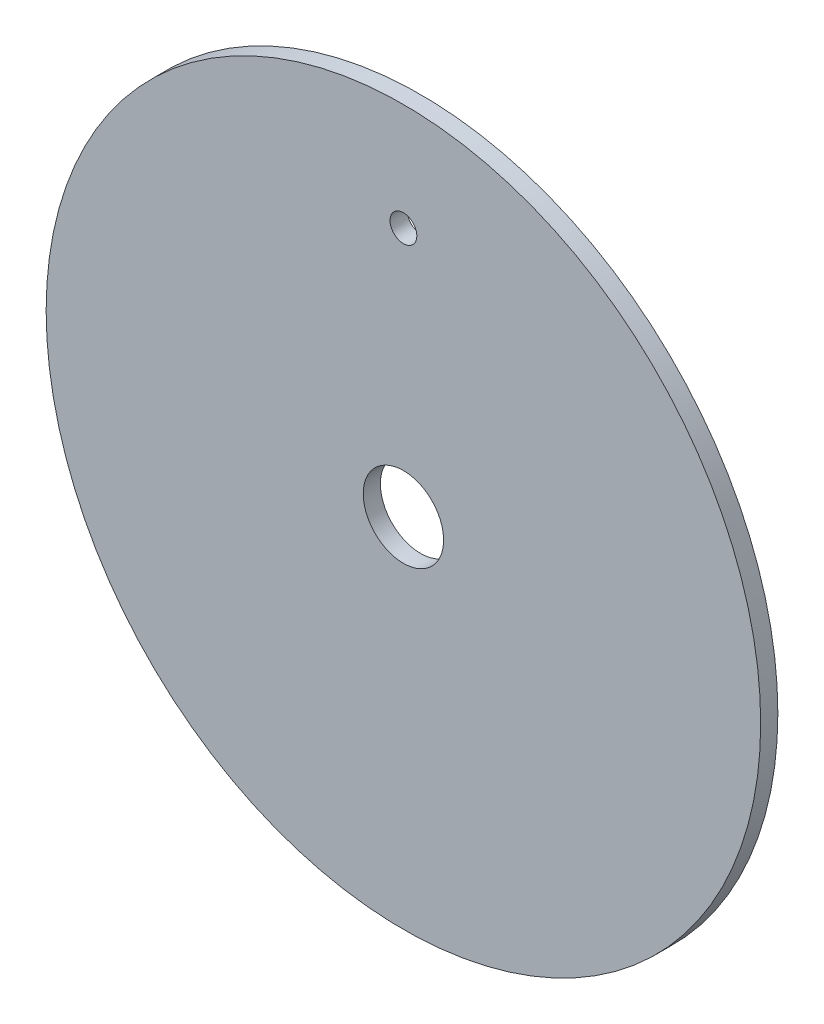
from build123d import *

# Parameters (mm, degrees)
SKETCH1_R           = 63.5
SKETCH1_R_2         = 7.14375
BOSS_EXTRUDE1_DEPTH = 3.048
SKETCH2_R           = 2.38125
CUT_EXTRUDE1_DEPTH  = 90.854272597


with BuildPart() as part:
    # Sketch1 → Boss-Extrude1 (new body)
    with BuildSketch(Plane.XY):
        with Locations(Location((0, 0, 0), (0, 0, 180))):
            Circle(SKETCH1_R)
        with Locations(Location((0, 0, 0), (0, 0, 180))):
            Circle(SKETCH1_R_2, mode=Mode.SUBTRACT)
    extrude(amount=BOSS_EXTRUDE1_DEPTH)

    # Sketch2 → Cut-Extrude1 (cut, through all)
    with BuildSketch(Plane.XY.offset(3.048)):
        with Locations((0, 44.45)):
            Circle(SKETCH2_R)
    extrude(amount=-CUT_EXTRUDE1_DEPTH, mode=Mode.SUBTRACT)


solid = part.part
